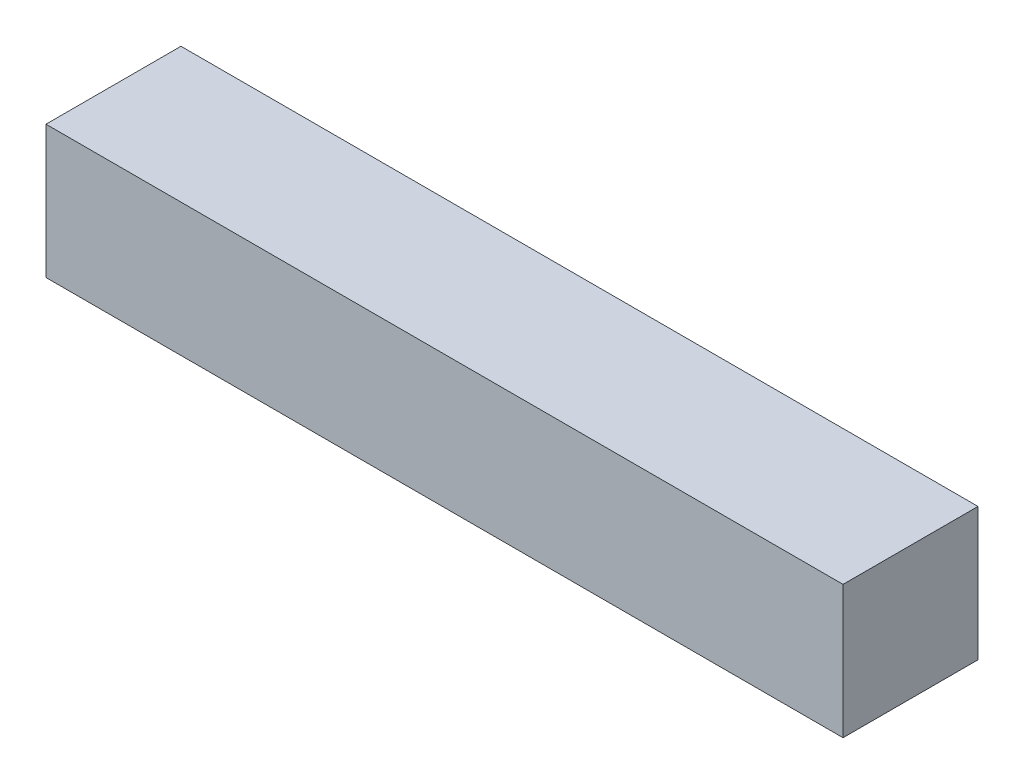
from build123d import *

# Parameters (mm, degrees)
SKETCH1_W           = 150
SKETCH1_H           = 25.4
BOSS_EXTRUDE1_DEPTH = 25


with BuildPart() as part:
    # Sketch1 → Boss-Extrude1 (new body)
    with BuildSketch(Plane(origin=(0, 0, 0), x_dir=(1, 0, 0), z_dir=(0, 1, 0))):
        Rectangle(SKETCH1_W, SKETCH1_H)
    extrude(amount=BOSS_EXTRUDE1_DEPTH)


solid = part.part
